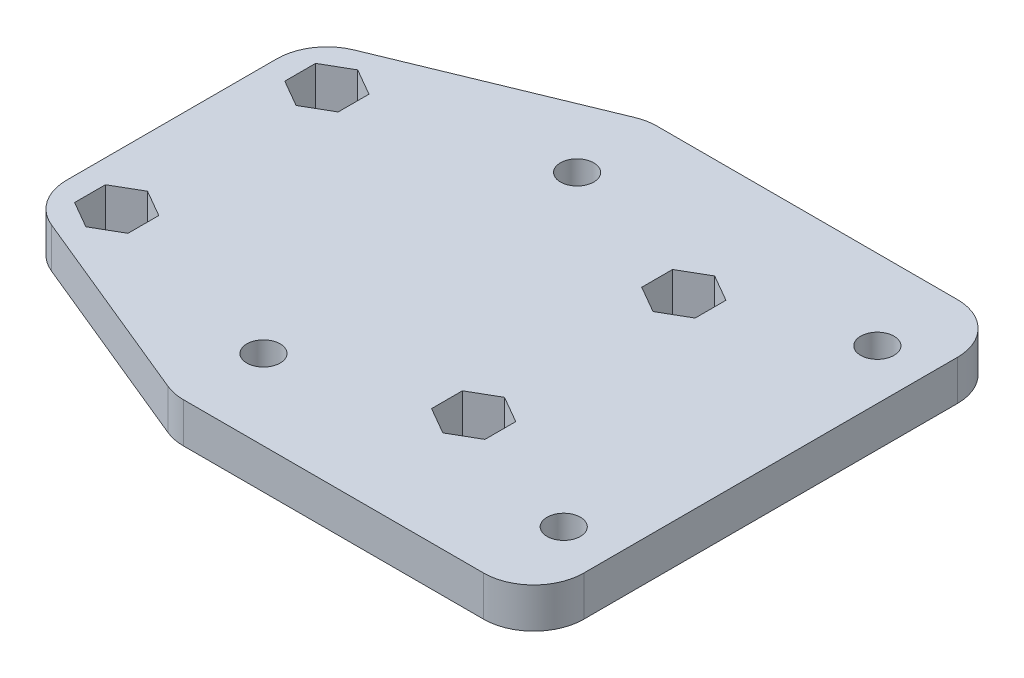
from build123d import *

# Parameters (mm, degrees)
SKETCH1_R               = 7.5
SKETCH1_R_2             = 2.75
SKETCH1_R_3             = 2.5
BOSS_EXTRUDE1_DEPTH     = 6
CUT_EXTRUDE1_DEPTH      = 70.758959998
CUT_EXTRUDE1_DEPTH_BACK = 70.758959998


with BuildPart() as part:
    # Sketch1 → Boss-Extrude1 (new body)
    # profile 1 of 7: a face of its own
    with BuildSketch(Plane(origin=(0, 0, 0), x_dir=(1, 0, 0), z_dir=(0, 1, 0))):
        with Locations((-52.25, 15.75)):
            Circle(SKETCH1_R)
        with Locations(Location((-52.25, 15.75, 0), (0, 0, 270))):
            Circle(SKETCH1_R_2, mode=Mode.SUBTRACT)
    # profile 2 of 7: a face of its own
    with BuildSketch(Plane(origin=(0, 0, 0), x_dir=(1, 0, 0), z_dir=(0, 1, 0))):
        with BuildLine():
            ThreePointArc((-44.75, 15.75), (-52.25, 8.25), (-59.75, 15.75))
            Line((-59.75, 15.75), (-59.75, -15.75))
            ThreePointArc((-59.75, -15.75), (-52.25, -8.25), (-44.75, -15.75))
            ThreePointArc((-44.75, -15.75), (-48.076702535, -21.981660154), (-55.105623539, -22.685085739))
            Line((-55.105623539, -22.685085739), (-25.355623539, -34.935085739))
            ThreePointArc((-25.355623539, -34.935085739), (-26.673297465, -21.768339846), (-15, -28))
            ThreePointArc((-15, -28), (-17.196699141, -33.303300859), (-22.5, -35.5))
            Line((-22.5, -35.5), (22.5, -35.5))
            ThreePointArc((22.5, -35.5), (17.196699141, -22.696699141), (30, -28))
            Line((30, -28), (30, 28))
            ThreePointArc((30, 28), (17.196699141, 22.696699141), (22.5, 35.5))
            Line((22.5, 35.5), (-22.5, 35.5))
            ThreePointArc((-22.5, 35.5), (-17.196699141, 33.303300859), (-15, 28))
            ThreePointArc((-15, 28), (-26.673297465, 21.768339846), (-25.355623539, 34.935085739))
            Line((-25.355623539, 34.935085739), (-55.105623539, 22.685085739))
            ThreePointArc((-55.105623539, 22.685085739), (-48.076702535, 21.981660154), (-44.75, 15.75))
        make_face()
        with Locations(Location((1.25, -15.75, 0), (0, 0, 270))):
            Circle(SKETCH1_R_2, mode=Mode.SUBTRACT)
        with Locations(Location((1.25, 15.75, 0), (0, 0, 270))):
            Circle(SKETCH1_R_2, mode=Mode.SUBTRACT)
    # profile 3 of 7: a face of its own
    with BuildSketch(Plane(origin=(0, 0, 0), x_dir=(1, 0, 0), z_dir=(0, 1, 0))):
        with Locations((-52.25, -15.75)):
            Circle(SKETCH1_R)
        with Locations(Location((-52.25, -15.75, 0), (0, 0, 270))):
            Circle(SKETCH1_R_2, mode=Mode.SUBTRACT)
    # profile 4 of 7: a face of its own
    with BuildSketch(Plane(origin=(0, 0, 0), x_dir=(1, 0, 0), z_dir=(0, 1, 0))):
        with Locations((-22.5, -28)):
            Circle(SKETCH1_R)
        with Locations(Location((-22.5, -23.5, 0), (0, 0, 270))):
            Circle(SKETCH1_R_3, mode=Mode.SUBTRACT)
    # profile 5 of 7: a face of its own
    with BuildSketch(Plane(origin=(0, 0, 0), x_dir=(1, 0, 0), z_dir=(0, 1, 0))):
        with Locations((22.5, -28)):
            Circle(SKETCH1_R)
        with Locations(Location((22.5, -23.5, 0), (0, 0, 270))):
            Circle(SKETCH1_R_3, mode=Mode.SUBTRACT)
    # profile 6 of 7: a face of its own
    with BuildSketch(Plane(origin=(0, 0, 0), x_dir=(1, 0, 0), z_dir=(0, 1, 0))):
        with Locations((22.5, 28)):
            Circle(SKETCH1_R)
        with Locations(Location((22.5, 23.5, 0), (0, 0, 270))):
            Circle(SKETCH1_R_3, mode=Mode.SUBTRACT)
    # profile 7 of 7: a face of its own
    with BuildSketch(Plane(origin=(0, 0, 0), x_dir=(1, 0, 0), z_dir=(0, 1, 0))):
        with Locations((-22.5, 28)):
            Circle(SKETCH1_R)
        with Locations(Location((-22.5, 23.5, 0), (0, 0, 270))):
            Circle(SKETCH1_R_3, mode=Mode.SUBTRACT)
    extrude(amount=BOSS_EXTRUDE1_DEPTH)

    # Sketch2 → Cut-Extrude1 (cut, two sides: drawn at the far end of the back side and taken through both)
    with BuildSketch(Plane(origin=(0, 6, 0), x_dir=(1, 0, 0), z_dir=(0, 1, 0)).offset(-CUT_EXTRUDE1_DEPTH_BACK)):
        Polygon((-52.25, 11.131197846), (-48.25, 13.440598923), (-48.25, 18.059401077), (-52.25, 20.368802154), (-56.25, 18.059401077), (-56.25, 13.440598923), align=None)
        Polygon((-52.25, -11.131197846), (-56.25, -13.440598923), (-56.25, -18.059401077), (-52.25, -20.368802154), (-48.25, -18.059401077), (-48.25, -13.440598923), align=None)
        Polygon((-2.75, -18.059401077), (1.25, -20.368802154), (5.25, -18.059401077), (5.25, -13.440598923), (1.25, -11.131197846), (-2.75, -13.440598923), align=None)
        Polygon((1.25, 11.131197846), (5.25, 13.440598923), (5.25, 18.059401077), (1.25, 20.368802154), (-2.75, 18.059401077), (-2.75, 13.440598923), align=None)
    extrude(amount=CUT_EXTRUDE1_DEPTH + CUT_EXTRUDE1_DEPTH_BACK, mode=Mode.SUBTRACT)


solid = part.part
